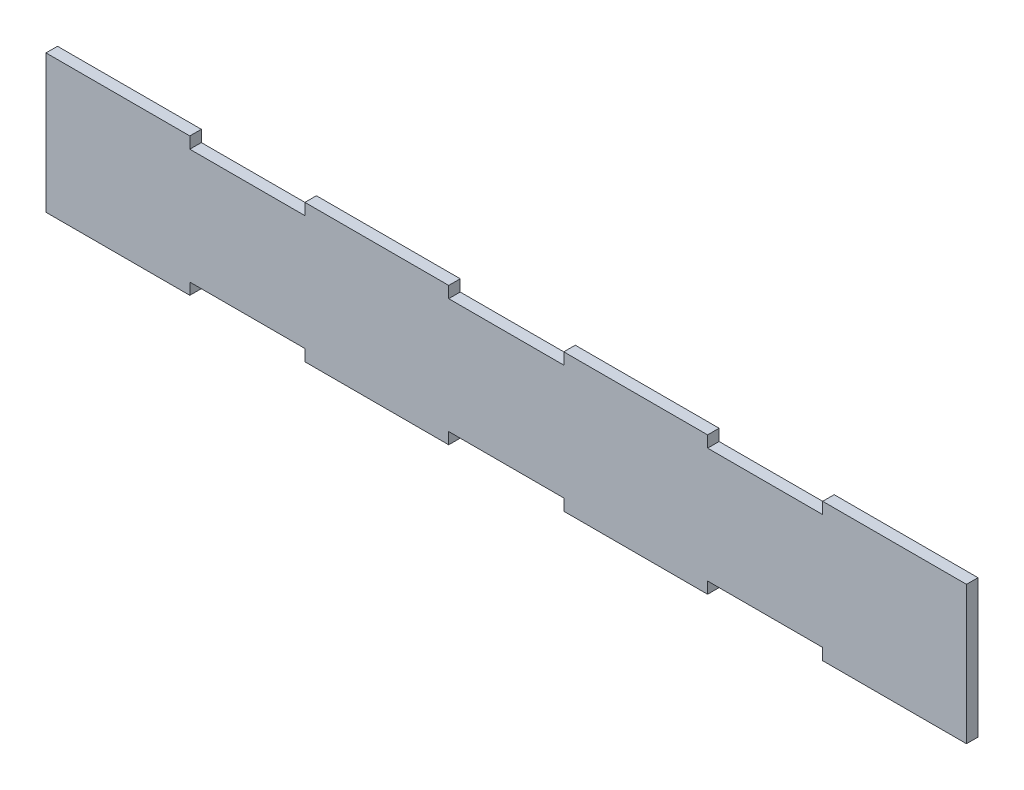
from build123d import *

# Parameters (mm, degrees)
EXTRUDE_1_DEPTH = 2


with BuildPart() as part:
    # Эскиз1 → Бобышка-Вытянуть1 (new body)
    with BuildSketch(Plane.XY):
        Polygon((0, 24), (0, 0), (25, 0), (25, 2), (45, 2), (45, 0), (70, 0), (70, 2), (90, 2), (90, 0), (115, 0), (115, 2), (135, 2), (135, 0), (160, 0), (160, 24), (135, 24), (135, 22), (115, 22), (115, 24), (90, 24), (90, 22), (70, 22), (70, 24), (45, 24), (45, 22), (25, 22), (25, 24), align=None)
    extrude(amount=EXTRUDE_1_DEPTH)


solid = part.part
